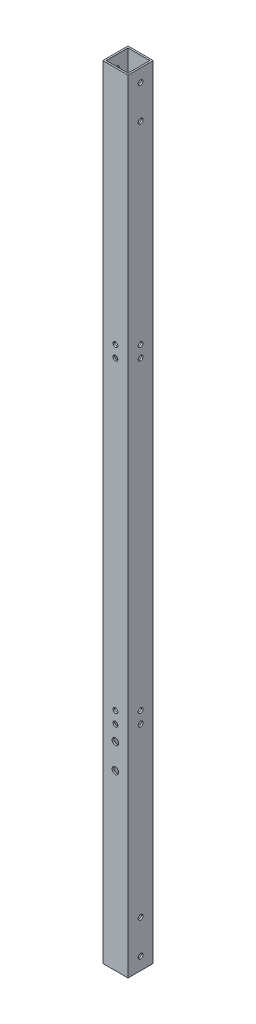
from build123d import *

# Parameters (mm, degrees)
SKETCH_1_W          = 15
SKETCH_1_H          = 15
SKETCH_1_W_2        = 13
SKETCH_1_H_2        = 13
EXTRUDE_1_DEPTH     = 465
SKETCH_2_R          = 1.95
SKETCH_2_R_2        = 1.45
CUT_EXTRUDE_1_DEPTH = 466.302321077
SKETCH_3_R          = 1.45
CUT_EXTRUDE_2_DEPTH = 466.302321077


with BuildPart() as part:
    # 草图1 → 拉伸-薄壁1 (new body)
    with BuildSketch(Plane(origin=(0, 0, 0), x_dir=(1, 0, 0), z_dir=(0, 1, 0))):
        Rectangle(SKETCH_1_W, SKETCH_1_H)
        Rectangle(SKETCH_1_W_2, SKETCH_1_H_2, mode=Mode.SUBTRACT)
    extrude(amount=EXTRUDE_1_DEPTH)

    # 草图2 → 切除-拉伸1 (cut, through all)
    with BuildSketch(Plane.XY.offset(7.5)):
        with Locations((0, 118)):
            Circle(SKETCH_2_R)
        with Locations((0, 103)):
            Circle(SKETCH_2_R)
        with Locations((0, 134)):
            Circle(SKETCH_2_R_2)
        with Locations((0, 127)):
            Circle(SKETCH_2_R_2)
        with Locations((0, 322.5)):
            Circle(SKETCH_2_R_2)
        with Locations((0, 315.5)):
            Circle(SKETCH_2_R_2)
    extrude(amount=-CUT_EXTRUDE_1_DEPTH, mode=Mode.SUBTRACT)

    # 草图3 → 切除-拉伸2 (cut, through all)
    with BuildSketch(Plane(origin=(7.5, 0, 0), x_dir=(0, 0, -1), z_dir=(1, 0, 0))):
        with Locations((0, 457.5)):
            Circle(SKETCH_3_R)
        with Locations((0, 437.5)):
            Circle(SKETCH_3_R)
        with Locations((0, 134)):
            Circle(SKETCH_3_R)
        with Locations((0, 127)):
            Circle(SKETCH_3_R)
        with Locations((0, 315.5)):
            Circle(SKETCH_3_R)
        with Locations((0, 322.5)):
            Circle(SKETCH_3_R)
        with Locations((0, 7.5)):
            Circle(SKETCH_3_R)
        with Locations((0, 27.5)):
            Circle(SKETCH_3_R)
    extrude(amount=-CUT_EXTRUDE_2_DEPTH, mode=Mode.SUBTRACT)


solid = part.part
